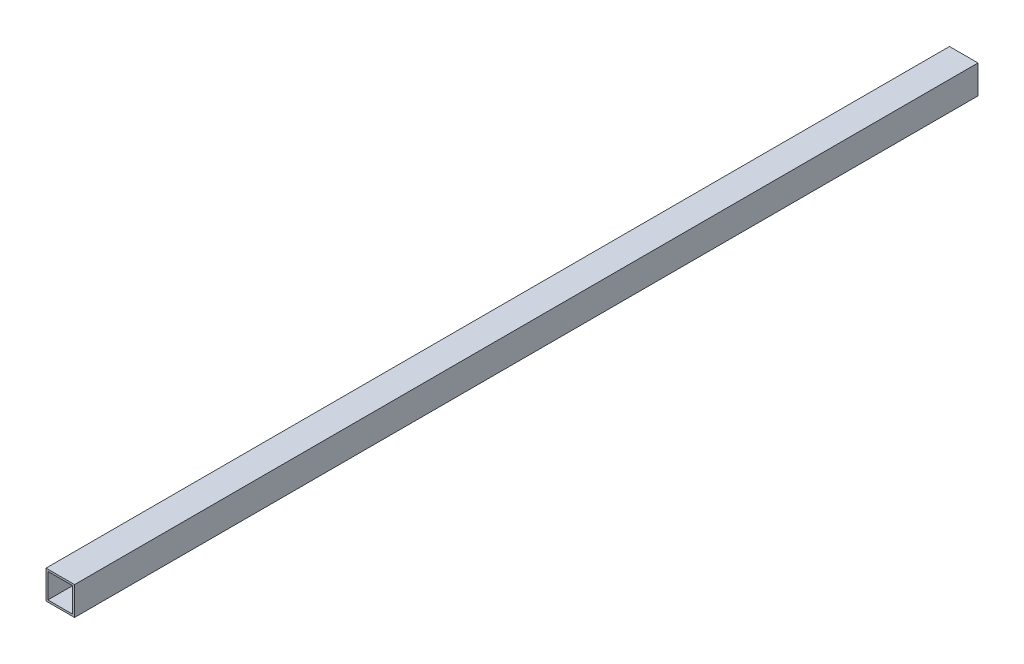
from build123d import *

# Parameters (mm, degrees)
CROQUIS1_W            = 30
CROQUIS1_H            = 30
CROQUIS1_W_2          = 26
CROQUIS1_H_2          = 26
EXTRUIR_L_MINA1_DEPTH = 950


with BuildPart() as part:
    # Croquis1 → Extruir-Lámina1 (new body)
    with BuildSketch(Plane.XY):
        Rectangle(CROQUIS1_W, CROQUIS1_H)
        Rectangle(CROQUIS1_W_2, CROQUIS1_H_2, mode=Mode.SUBTRACT)
    extrude(amount=EXTRUIR_L_MINA1_DEPTH)


solid = part.part
